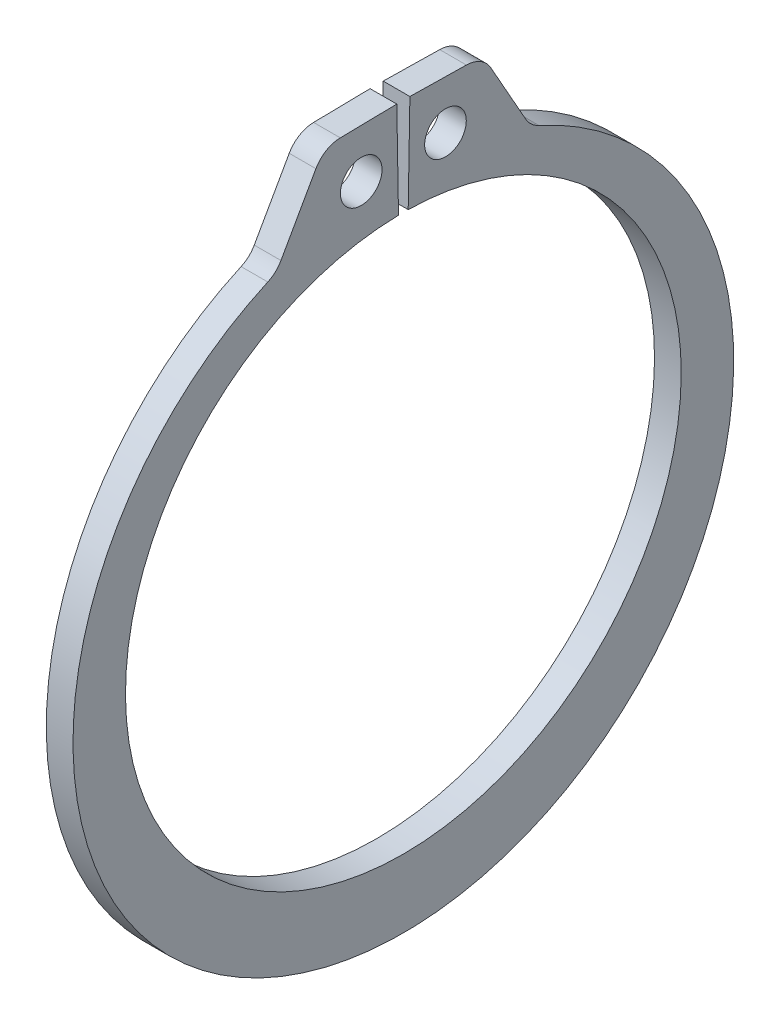
from build123d import *

# Parameters (mm, degrees)
SKETCH1_R      = 0.9906
EXTRUDE1_DEPTH = 0.635
FILLET1_R      = 1.3589


with BuildPart() as part:
    # Sketch1 → Extrude1 (new, symmetric)
    with BuildSketch(Plane(origin=(0, 0, 0), x_dir=(0, 0, -1), z_dir=(1, 0, 0))):
        with BuildLine():
            Line((-0.23073303, 13.218686423), (-0.311412014, 17.840782349))
            Line((-0.311412014, 17.840782349), (-3.777983958, 17.78027311))
            Line((-3.777983958, 17.78027311), (-6.047809043, 13.75309371))
            ThreePointArc((-6.047809043, 13.75309371), (0, -16.4719), (6.047809043, 13.75309371))
            Line((6.047809043, 13.75309371), (3.777983958, 17.78027311))
            Line((3.777983958, 17.78027311), (0.311412014, 17.840782349))
            Line((0.311412014, 17.840782349), (0.23073303, 13.218686423))
            ThreePointArc((0.23073303, 13.218686423), (0, -13.2207), (-0.23073303, 13.218686423))
        make_face()
        with Locations((-2.004358494, 15.499479767)):
            Circle(SKETCH1_R, mode=Mode.SUBTRACT)
        with Locations((2.004358494, 15.499479767)):
            Circle(SKETCH1_R, mode=Mode.SUBTRACT)
    extrude(amount=EXTRUDE1_DEPTH, both=True)

    # Fillet1
    fillet1_edges = [part.edges().sort_by_distance(p)[0] for p in [
        (0, 17.78027311, -3.777983958),
        (0, 13.75309371, -6.047809043),
        (0, 13.75309371, 6.047809043),
        (0, 17.78027311, 3.777983958),
    ]]
    fillet(fillet1_edges, radius=FILLET1_R)


solid = part.part
